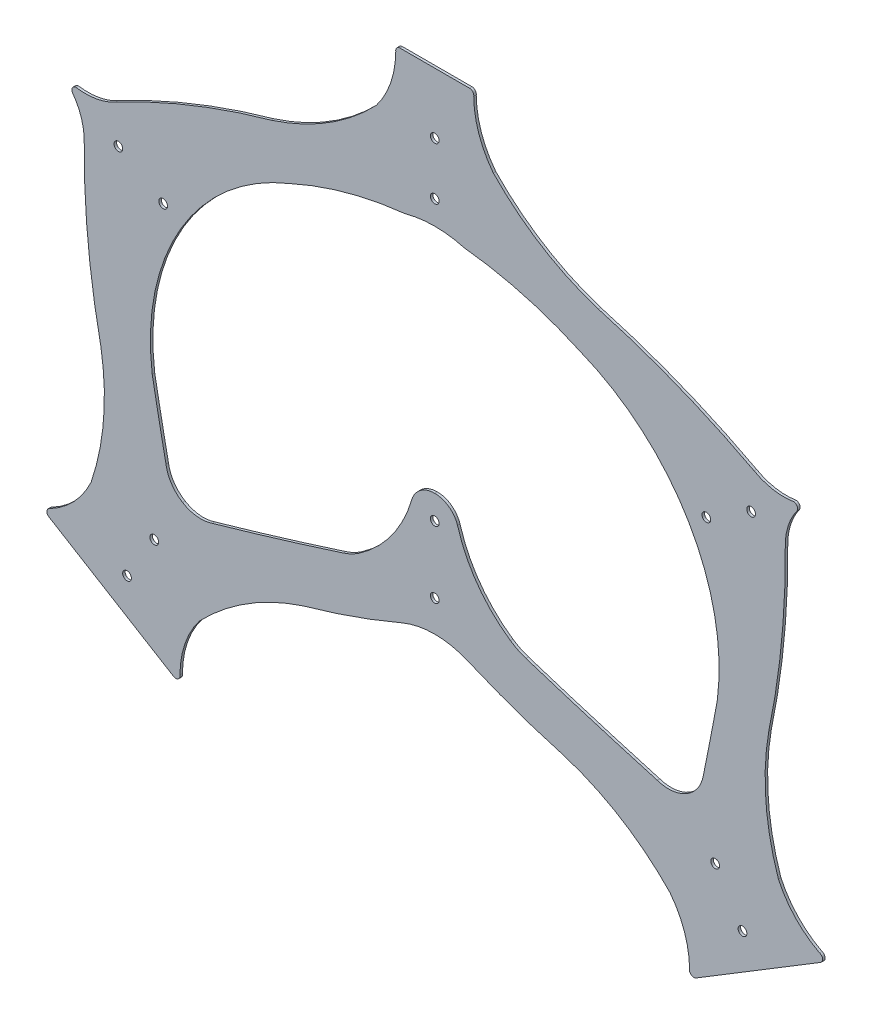
from build123d import *

# Parameters (mm, degrees)
MODEL_R             = 11.1125
BOSS_EXTRUDE1_DEPTH = 6.35


with BuildPart() as part:
    # Model → Boss-Extrude1 (new body)
    with BuildSketch(Plane.XY):
        with BuildLine():
            Line((5.108110735, 194.314892531), (163.618010499, 97.941859293))
            Line((163.618010499, 97.941859293), (322.127910263, 1.568826055))
            ThreePointArc((322.127910263, 1.568826055), (333.89428898, 1.914633478), (338.370752597, 12.801714096))
            ThreePointArc((338.370752597, 12.801714096), (351.434447306, 88.848287087), (388.196442443, 156.688519227))
            ThreePointArc((388.196442443, 156.688519227), (408.690944842, 177.077381556), (430.088955815, 196.51588618))
            ThreePointArc((430.088955815, 196.51588618), (536.177956286, 271.113973278), (655.171731621, 322.6914107))
            ThreePointArc((655.171731621, 322.6914107), (780.029083347, 362.033385202), (902.029382318, 409.499965959))
            ThreePointArc((902.029382318, 409.499965959), (943.4927889, 422.476908859), (986.713439487, 426.903024))
            ThreePointArc((986.713439487, 426.903024), (1029.934090103, 422.476908864), (1071.397496712, 409.499965959))
            ThreePointArc((1071.397496712, 409.499965959), (1193.397795685, 362.033385202), (1318.255147412, 322.691410699))
            ThreePointArc((1318.255147412, 322.691410699), (1437.248922745, 271.113973277), (1543.337923214, 196.51588618))
            ThreePointArc((1543.337923214, 196.51588618), (1564.735934188, 177.077381556), (1585.230436587, 156.688519227))
            ThreePointArc((1585.230436587, 156.688519227), (1621.992431724, 88.848287087), (1635.056126433, 12.801714096))
            ThreePointArc((1635.056126433, 12.801714096), (1639.53259005, 1.914633478), (1651.298968767, 1.568826055))
            Line((1651.298968767, 1.568826055), (1809.808868531, 97.941859293))
            Line((1809.808868531, 97.941859293), (1968.318768295, 194.314892531))
            ThreePointArc((1968.318768295, 194.314892531), (1973.426883996, 204.920287614), (1965.821440542, 213.90496795))
            ThreePointArc((1965.821440542, 213.90496795), (1904.319104128, 260.501148039), (1861.008833141, 324.360069187))
            ThreePointArc((1861.008833141, 324.360069187), (1829.125136948, 479.534965955), (1836.498090618, 637.779897071))
            ThreePointArc((1836.498090618, 637.779897071), (1868.895348354, 849.044814678), (1878.445908783, 1062.565854661))
            ThreePointArc((1878.445908783, 1062.565854661), (1885.489759902, 1113.896449039), (1909.00192278, 1160.065962298))
            ThreePointArc((1909.00192278, 1160.065962298), (1909.937478003, 1165.173079083), (1908.384310543, 1170.127428311))
            ThreePointArc((1908.384310543, 1170.127428311), (1904.700614553, 1173.786429442), (1899.735930337, 1175.306237344))
            ThreePointArc((1899.735930337, 1175.306237344), (1847.925642431, 1175.680168978), (1799.112371696, 1193.049980658))
            ThreePointArc((1799.112371696, 1193.049980658), (1605.15200634, 1282.837643457), (1402.680125607, 1351.303585593))
            ThreePointArc((1402.680125607, 1351.303585593), (1283.68635027, 1402.881023015), (1177.597349797, 1477.479110114))
            ThreePointArc((1177.597349797, 1477.479110114), (1156.199338824, 1496.917614738), (1135.704836425, 1517.306477067))
            ThreePointArc((1135.704836425, 1517.306477067), (1098.942841288, 1585.146709207), (1085.879146579, 1661.193282198))
            ThreePointArc((1085.879146579, 1661.193282198), (1083.573474575, 1670.091826663), (1075.253069645, 1673.999649433))
            Line((1075.253069645, 1673.999649433), (987.410269122, 1673.999649433))
            Line((987.410269122, 1673.999649433), (986.016609907, 1673.999649433))
            Line((986.016609907, 1673.999649433), (898.173809384, 1673.999649433))
            ThreePointArc((898.173809384, 1673.999649433), (889.853404455, 1670.091826664), (887.54773245, 1661.193282198))
            ThreePointArc((887.54773245, 1661.193282198), (874.484037741, 1585.146709206), (837.722042605, 1517.306477067))
            ThreePointArc((837.722042605, 1517.306477067), (817.227540206, 1496.917614738), (795.829529232, 1477.479110114))
            ThreePointArc((795.829529232, 1477.479110114), (689.74052876, 1402.881023015), (570.746753423, 1351.303585593))
            ThreePointArc((570.746753423, 1351.303585593), (368.274872692, 1282.837643458), (174.314507337, 1193.04998066))
            ThreePointArc((174.314507337, 1193.04998066), (125.5012366, 1175.680168978), (73.690948693, 1175.306237344))
            ThreePointArc((73.690948693, 1175.306237344), (68.726264477, 1173.786429442), (65.042568486, 1170.127428311))
            ThreePointArc((65.042568486, 1170.127428311), (63.489401027, 1165.173079083), (64.42495625, 1160.065962298))
            ThreePointArc((64.42495625, 1160.065962298), (87.937119128, 1113.896449039), (94.980970247, 1062.565854661))
            ThreePointArc((94.980970247, 1062.565854661), (104.531530676, 849.044814678), (136.928788412, 637.779897071))
            ThreePointArc((136.928788412, 637.779897071), (144.301742082, 479.534965955), (112.418045889, 324.360069187))
            ThreePointArc((112.418045889, 324.360069187), (69.107774901, 260.501148039), (7.605438488, 213.90496795))
            ThreePointArc((7.605438488, 213.90496795), (-4.967e-06, 204.920287614), (5.108110735, 194.314892531))
        make_face()
        with Locations((203.802894797, 164.060426103)):
            Circle(MODEL_R, mode=Mode.SUBTRACT)
        with Locations((273.165559958, 278.186921443)):
            Circle(MODEL_R, mode=Mode.SUBTRACT)
        with Locations((1769.623984233, 164.060426103)):
            Circle(MODEL_R, mode=Mode.SUBTRACT)
        with Locations((1700.261319072, 278.186921443)):
            Circle(MODEL_R, mode=Mode.SUBTRACT)
        with Locations((986.713439515, 506.390428564)):
            Circle(MODEL_R, mode=Mode.SUBTRACT)
        with Locations((986.713439515, 676.157132765)):
            Circle(MODEL_R, mode=Mode.SUBTRACT)
        with Locations((295.723951941, 1029.874581844)):
            Circle(MODEL_R, mode=Mode.SUBTRACT)
        with Locations((181.78107034, 1099.151145215)):
            Circle(MODEL_R, mode=Mode.SUBTRACT)
        with BuildLine():
            Line((345.096905092, 396.320114284), (344.999404352, 396.379394127))
            ThreePointArc((344.999404352, 396.379394127), (316.936053956, 423.300977152), (302.89359528, 459.565734456))
            ThreePointArc((302.89359528, 459.565734456), (284.961704097, 549.837677781), (267.850648214, 640.268802068))
            ThreePointArc((267.850648214, 640.268802068), (340.626263773, 997.19517935), (616.781657489, 1234.747126388))
            ThreePointArc((616.781657489, 1234.747126388), (760.772078282, 1287.024528435), (911.280552404, 1315.544122787))
            ThreePointArc((911.280552404, 1315.544122787), (948.659010331, 1323.142774148), (986.713439625, 1325.740663802))
            ThreePointArc((986.713439625, 1325.740663802), (1024.767868806, 1323.142774133), (1062.146326623, 1315.544122787))
            ThreePointArc((1062.146326623, 1315.544122787), (1212.654800747, 1287.024528436), (1356.64522154, 1234.747126389))
            ThreePointArc((1356.64522154, 1234.747126389), (1632.800615257, 997.195179351), (1705.576230816, 640.268802068))
            ThreePointArc((1705.576230816, 640.268802068), (1688.465174933, 549.837677782), (1670.533283749, 459.565734456))
            ThreePointArc((1670.533283749, 459.565734456), (1656.490825211, 423.300977357), (1628.4274751, 396.379394384))
            Line((1628.4274751, 396.379394384), (1628.329973938, 396.320114284))
            ThreePointArc((1628.329973938, 396.320114284), (1609.378608682, 387.631389964), (1588.933978787, 383.54907642))
            ThreePointArc((1588.933978787, 383.54907642), (1570.665812577, 383.937789322), (1552.854893643, 388.018005146))
            ThreePointArc((1552.854893643, 388.018005146), (1385.349426739, 437.316504437), (1218.71849884, 489.49463532))
            ThreePointArc((1218.71849884, 489.49463532), (1198.339741351, 497.735086266), (1179.358454519, 508.821543715))
            ThreePointArc((1179.358454519, 508.821543715), (1095.776005774, 590.387750311), (1044.679373403, 695.403015663))
            ThreePointArc((1044.679373403, 695.403015663), (1022.521857597, 725.776812519), (986.713439515, 737.234571316))
            ThreePointArc((986.713439515, 737.234571316), (950.905021434, 725.776812519), (928.747505628, 695.403015664))
            ThreePointArc((928.747505628, 695.403015664), (877.650873256, 590.387750312), (794.068424511, 508.821543716))
            ThreePointArc((794.068424511, 508.821543716), (775.087137679, 497.735086266), (754.70838019, 489.49463532))
            ThreePointArc((754.70838019, 489.49463532), (588.077452291, 437.316504437), (420.571985387, 388.018005147))
            ThreePointArc((420.571985387, 388.018005147), (402.761066453, 383.937789322), (384.492900242, 383.54907642))
            ThreePointArc((384.492900242, 383.54907642), (364.048270348, 387.631389964), (345.096905092, 396.320114284))
        make_face(mode=Mode.SUBTRACT)
        with Locations((1677.702927089, 1029.874581844)):
            Circle(MODEL_R, mode=Mode.SUBTRACT)
        with Locations((1791.64580869, 1099.151145215)):
            Circle(MODEL_R, mode=Mode.SUBTRACT)
        with Locations((986.713439515, 1386.202197897)):
            Circle(MODEL_R, mode=Mode.SUBTRACT)
        with Locations((986.713439515, 1519.552197898)):
            Circle(MODEL_R, mode=Mode.SUBTRACT)
    extrude(amount=BOSS_EXTRUDE1_DEPTH)


solid = part.part
